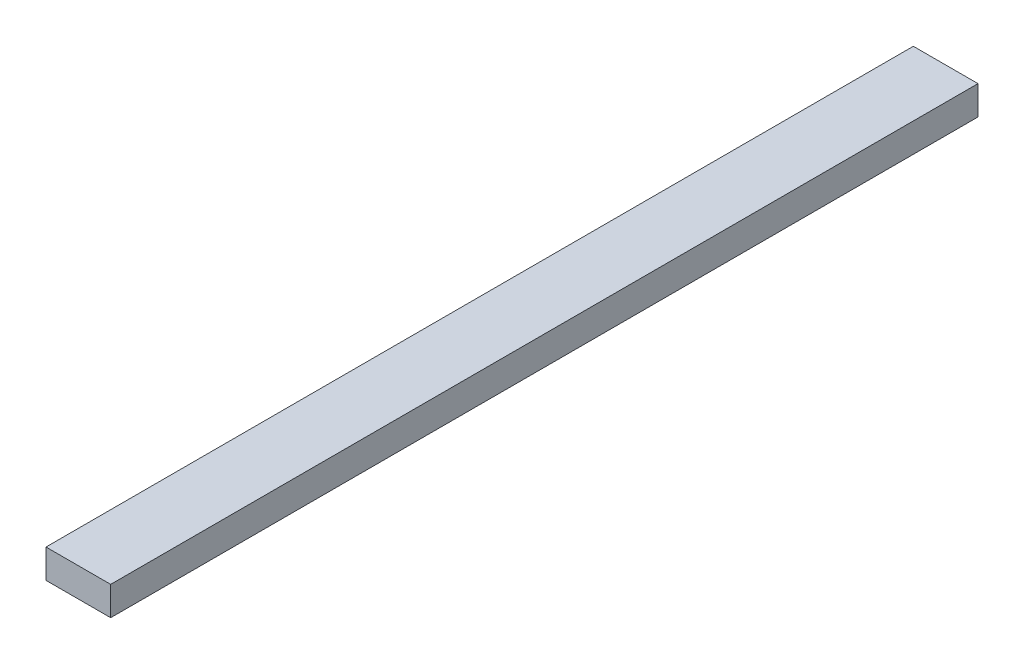
from build123d import *

# Parameters (mm, degrees)
SKETCH1_W           = 16.6624
SKETCH1_H           = 37.2872
BOSS_EXTRUDE1_DEPTH = 250


with BuildPart() as part:
    # Sketch1 → Boss-Extrude1 (new, symmetric)
    with BuildSketch(Plane(origin=(0, 0, 0), x_dir=(0, 1, 0), z_dir=(0, 0, 1))):
        Rectangle(SKETCH1_W, SKETCH1_H)
    extrude(amount=BOSS_EXTRUDE1_DEPTH, both=True)


solid = part.part
